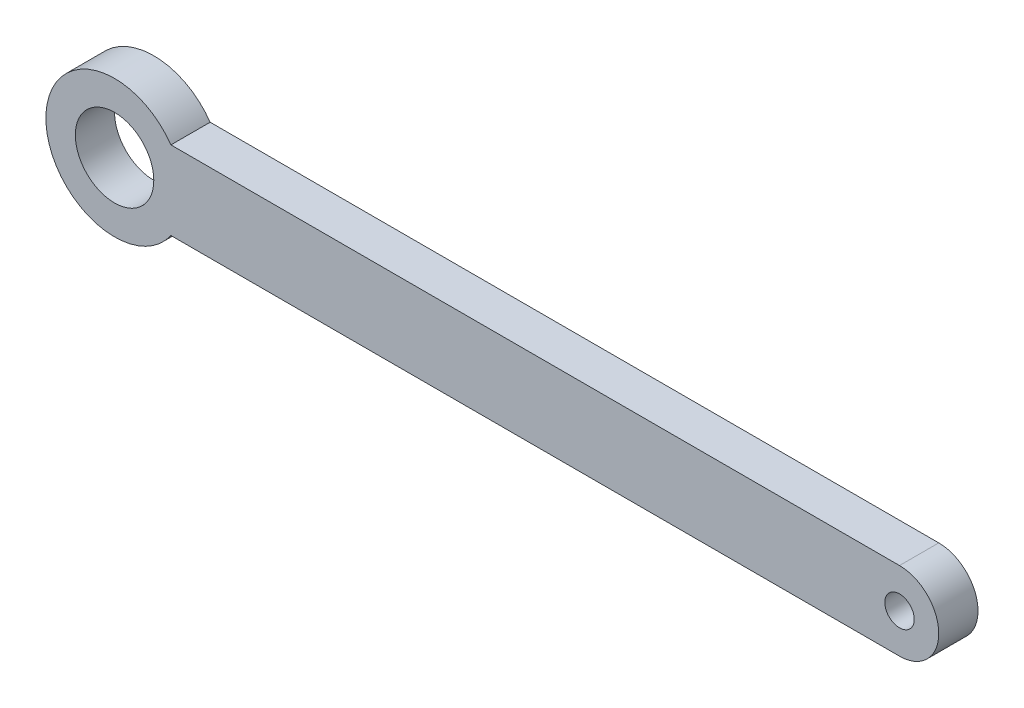
from build123d import *

# Parameters (mm, degrees)
BOSS_EXTRUDE1_DEPTH     = 2
SKETCH2_R               = 2
BOSS_EXTRUDE2_DEPTH     = 8
CROQUIS1_R              = 0.75
CORTAR_EXTRUIR1_DEPTH   = 10
CORTAR_EXTRUIR2_START   = -16
CROQUIS2_R              = 2
CORTAR_EXTRUIR2_DEPTH   = 16
SALIENTE_EXTRUIR1_START = -2
CROQUIS3_R              = 3.5
CROQUIS3_R_2            = 2
SALIENTE_EXTRUIR1_DEPTH = 2


with BuildPart() as part:
    # Sketch1 → Boss-Extrude1 (new body)
    with BuildSketch(Plane.XY):
        with BuildLine():
            Line((0, -2), (40, -2))
            ThreePointArc((40, -2), (42, 0), (40, 2))
            Line((40, 2), (0, 2))
            ThreePointArc((0, 2), (-2, 0), (0, -2))
        make_face()
    extrude(amount=BOSS_EXTRUDE1_DEPTH)

    # Sketch2 → Boss-Extrude2 (add)
    with BuildSketch(Plane.XY.offset(2)):
        with Locations(Location((0, 0, 0), (0, 0, 270))):
            Circle(SKETCH2_R)
    extrude(amount=BOSS_EXTRUDE2_DEPTH)

    # Croquis1 → Cortar-Extruir1 (cut)
    with BuildSketch(Plane.XY.offset(2)):
        with Locations((40, 0)):
            Circle(CROQUIS1_R)
    extrude(amount=-CORTAR_EXTRUIR1_DEPTH, mode=Mode.SUBTRACT)

    # Croquis2 → Cortar-Extruir2 (cut)
    with BuildSketch(Plane.XY.offset(10).offset(CORTAR_EXTRUIR2_START)):
        Circle(CROQUIS2_R)
    extrude(amount=CORTAR_EXTRUIR2_DEPTH, mode=Mode.SUBTRACT)

    # Croquis3 → Saliente-Extruir1 (add)
    with BuildSketch(Plane.XY.offset(2).offset(SALIENTE_EXTRUIR1_START)):
        Circle(CROQUIS3_R)
        Circle(CROQUIS3_R_2, mode=Mode.SUBTRACT)
    extrude(amount=SALIENTE_EXTRUIR1_DEPTH)


solid = part.part
